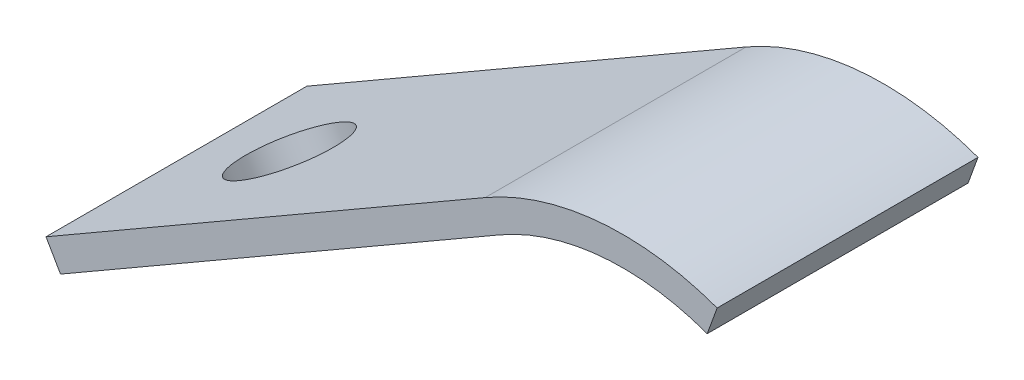
from build123d import *

# Parameters (mm, degrees)
EXTRUDE_1_DEPTH     = 9
SKETCH_2_R          = 3.5
CUT_EXTRUDE_1_DEPTH = 18


with BuildPart() as part:
    # 草图1 → 凸台-拉伸1 (new, symmetric)
    with BuildSketch(Plane.XY):
        with BuildLine():
            Line((-38.810889132, -2.777568136), (-8.5, 14.722431864))
            ThreePointArc((-8.5, 14.722431864), (-1.481647627, 16.935309868), (5.814342437, 15.974774553))
            Line((5.814342437, 15.974774553), (6.498382723, 17.854159795))
            ThreePointArc((6.498382723, 17.854159795), (-1.655959112, 18.927699264), (-9.5, 16.454482672))
            Line((-9.5, 16.454482672), (-39.810889132, -1.045517328))
            Line((-39.810889132, -1.045517328), (-38.810889132, -2.777568136))
        make_face()
    extrude(amount=EXTRUDE_1_DEPTH, both=True)

    # 草图2 → 切除-拉伸1 (cut)
    with BuildSketch(Plane(origin=(-9.5, 16.454482672, 0), x_dir=(0.8660254037844398, 0.49999999999999806, 0), z_dir=(-0.49999999999999806, 0.8660254037844398, 0))):
        with Locations(Location((-26, 0, 0), (0, 0, 180))):
            Circle(SKETCH_2_R)
    extrude(amount=-CUT_EXTRUDE_1_DEPTH, mode=Mode.SUBTRACT)


solid = part.part
